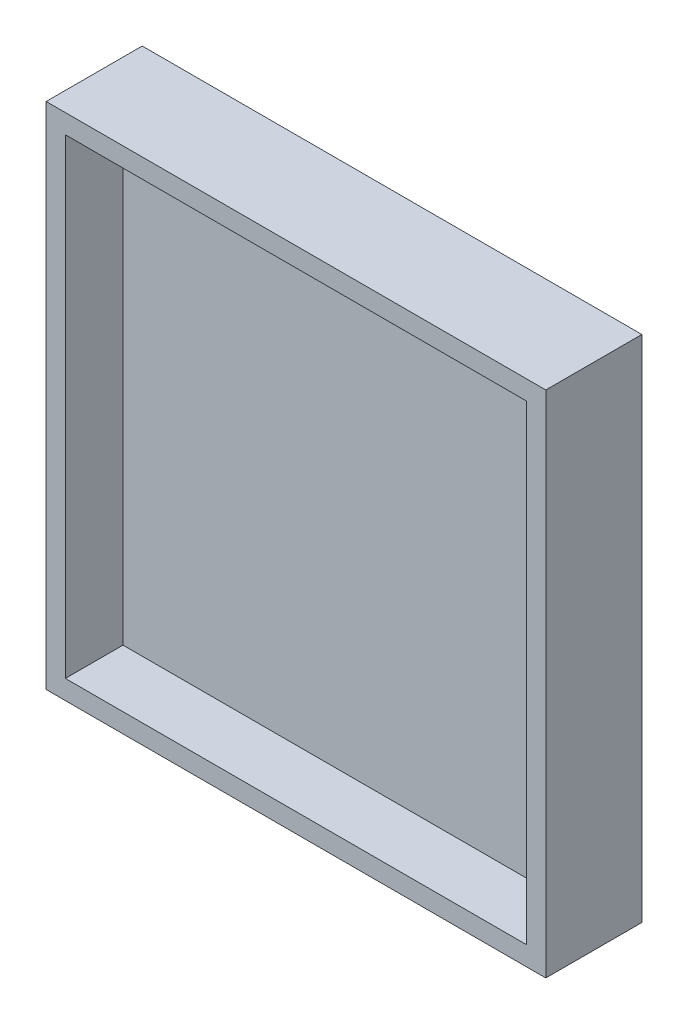
from build123d import *

# Parameters (mm, degrees)
SKETCH_1_W      = 26
SKETCH_1_H      = 26.5
SKETCH_1_W_2    = 24
SKETCH_1_H_2    = 24.5
EXTRUDE_1_DEPTH = 3
SKETCH_2_W      = 26
SKETCH_2_H      = 26.5
EXTRUDE_2_DEPTH = 2


with BuildPart() as part:
    # 草图1 → 凸台-拉伸1 (new body)
    with BuildSketch(Plane.XY):
        with Locations((12, 12.25)):
            Rectangle(SKETCH_1_W, SKETCH_1_H)
        with Locations((12, 12.25)):
            Rectangle(SKETCH_1_W_2, SKETCH_1_H_2, mode=Mode.SUBTRACT)
    extrude(amount=EXTRUDE_1_DEPTH)

    # 草图2 → 凸台-拉伸2 (add)
    with BuildSketch(Plane(origin=(0, 0, 0), x_dir=(-1, 0, 0), z_dir=(0, 0, -1))):
        with Locations((-12, 12.25)):
            Rectangle(SKETCH_2_W, SKETCH_2_H)
    extrude(amount=EXTRUDE_2_DEPTH)


solid = part.part
